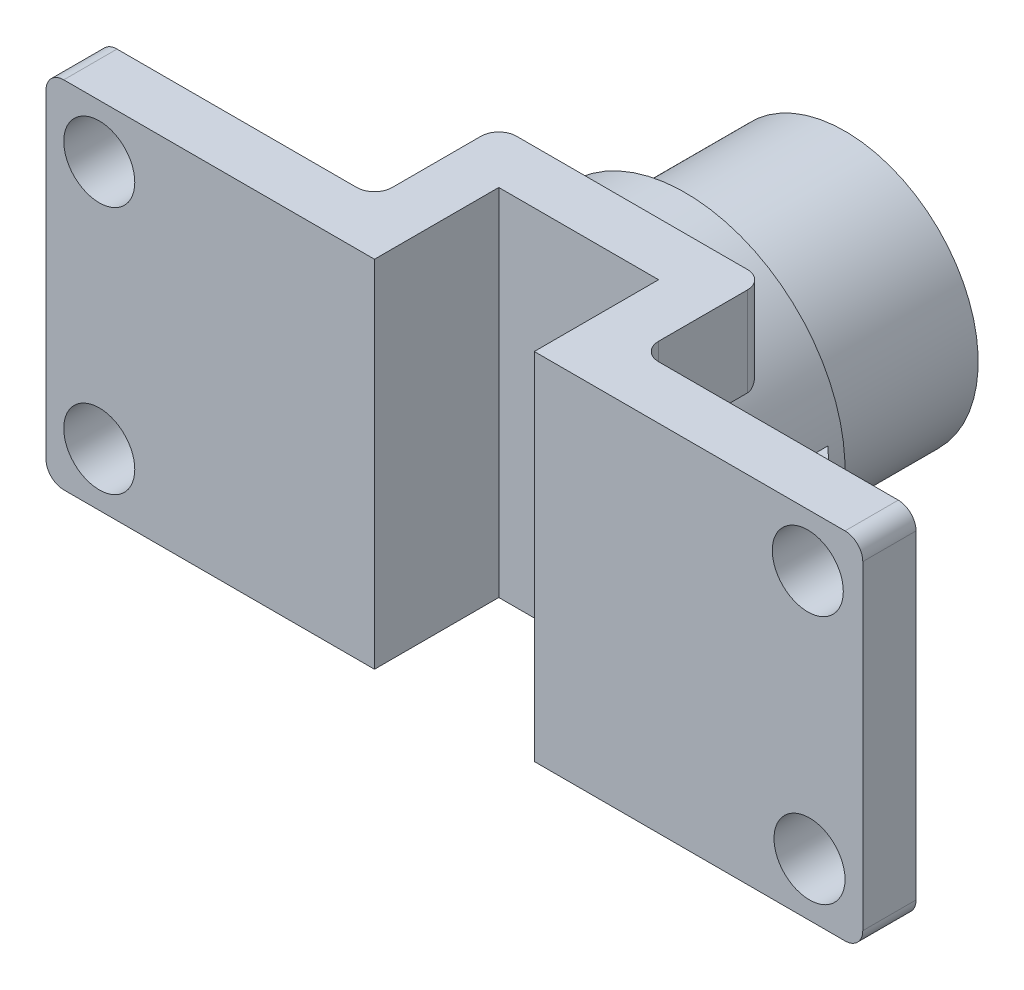
from build123d import *

# Parameters (mm, degrees)
BOSS_EXTRUDE1_DEPTH = 40
BOSS_EXTRUDE2_REACH = 105.634
SKETCH2_R           = 18
SKETCH3_R           = 15
SKETCH3_R_2         = 10
BOSS_EXTRUDE3_DEPTH = 18
BOSS_EXTRUDE5_DEPTH = 3
SKETCH5_W           = 20
SKETCH5_H           = 1.869521783
BOSS_EXTRUDE6_DEPTH = 6
SKETCH6_W           = 20
SKETCH6_H           = 1.869521783
BOSS_EXTRUDE7_DEPTH = 6
SKETCH8_W           = 18
SKETCH8_H           = 14
CUT_EXTRUDE1_DEPTH  = 119.321595713
FILLET1_R           = 2
SKETCH9_R           = 4
CUT_EXTRUDE2_DEPTH  = 6


with BuildPart() as part:
    # Sketch1 → Boss-Extrude1 (new body)
    with BuildSketch(Plane(origin=(0, 0, 0), x_dir=(1, 0, 0), z_dir=(0, 1, 0))):
        with BuildLine():
            Line((0, 0), (92, 0))
            Line((92, 0), (92, 6))
            Line((92, 6), (63, 6))
            ThreePointArc((63, 6), (61.585786438, 6.585786438), (61, 8))
            Line((61, 8), (61, 18))
            ThreePointArc((61, 18), (60.414213562, 19.414213562), (59, 20))
            Line((59, 20), (33, 20))
            ThreePointArc((33, 20), (31.585786438, 19.414213562), (31, 18))
            Line((31, 18), (31, 8))
            ThreePointArc((31, 8), (30.414213562, 6.585786438), (29, 6))
            Line((29, 6), (0, 6))
            Line((0, 6), (0, 0))
        make_face()
    extrude(amount=BOSS_EXTRUDE1_DEPTH)

    # Boss-Extrude2: up to this face of the body (flat: up to its plane)
    boss_extrude2_end = Plane(part.part.faces().sort_by_distance((14.5, 20, -6))[0])
    # Sketch2 → Boss-Extrude2 (add, up to the picked face)
    with BuildSketch(Plane(origin=(0, 0, -26), x_dir=(-1, 0, 0), z_dir=(0, 0, -1)), mode=Mode.PRIVATE) as boss_extrude2_sk1:
        with Locations((-46, 20)):
            Circle(SKETCH2_R)
    boss_extrude2_tool1 = split(extrude(boss_extrude2_sk1.sketch, amount=-BOSS_EXTRUDE2_REACH, mode=Mode.PRIVATE), bisect_by=boss_extrude2_end, keep=Keep.BOTH, mode=Mode.PRIVATE)
    add(boss_extrude2_tool1.solids().sort_by(Axis((46, 20, -26), (0, 0, 1)))[0])

    # Sketch3 → Boss-Extrude3 (add)
    with BuildSketch(Plane(origin=(0, 0, -26), x_dir=(-1, 0, 0), z_dir=(0, 0, -1))):
        with Locations((-46, 20)):
            Circle(SKETCH3_R)
        with Locations((-46, 20)):
            Circle(SKETCH3_R_2, mode=Mode.SUBTRACT)
    extrude(amount=BOSS_EXTRUDE3_DEPTH)

    # Sketch4 → Boss-Extrude5 (add, symmetric)
    with BuildSketch(Plane(origin=(0, 20, 0), x_dir=(-1, 0, 0), z_dir=(0, -1, 0))):
        Polygon((-61.98666838, 26), (-83, 6), (-61.98666838, 6), align=None)
        Polygon((-28.035534547, 26), (-9, 6), (-28.035534547, 6), align=None)
    extrude(amount=BOSS_EXTRUDE5_DEPTH, both=True)

    # Sketch5 → Boss-Extrude6 (add)
    with BuildSketch(Plane(origin=(28.035534547, 0, 0), x_dir=(0, 0, -1), z_dir=(1, 0, 0))):
        with Locations((16, 17.934760891)):
            Rectangle(SKETCH5_W, SKETCH5_H)
    extrude(amount=BOSS_EXTRUDE6_DEPTH)

    # Sketch6 → Boss-Extrude7 (add)
    with BuildSketch(Plane(origin=(28.035534547, 0, 0), x_dir=(0, 0, -1), z_dir=(1, 0, 0))):
        with Locations((16, 22.065239109)):
            Rectangle(SKETCH6_W, SKETCH6_H)
    extrude(amount=BOSS_EXTRUDE7_DEPTH)

    # Sketch8 → Cut-Extrude1 (cut, through all)
    with BuildSketch(Plane(origin=(0, 60, 0), x_dir=(1, 0, 0), z_dir=(0, 1, 0))):
        with Locations((46, 7)):
            Rectangle(SKETCH8_W, SKETCH8_H)
    extrude(amount=-CUT_EXTRUDE1_DEPTH, mode=Mode.SUBTRACT)

    # Fillet1
    fillet1_edges = [part.edges().sort_by_distance(p)[0] for p in [
        (92, 40, -3),
        (92, 0, -3),
        (0, 0, -3),
        (0, 40, -3),
    ]]
    fillet(fillet1_edges, radius=FILLET1_R)

    # Sketch9 → Cut-Extrude2 (cut)
    with BuildSketch(Plane.XY):
        with Locations((86, 6)):
            Circle(SKETCH9_R)
        with Locations((85.806998085, 34)):
            Circle(SKETCH9_R)
        with Locations((6, 34)):
            Circle(SKETCH9_R)
        with Locations((6, 6)):
            Circle(SKETCH9_R)
    extrude(amount=-CUT_EXTRUDE2_DEPTH, mode=Mode.SUBTRACT)


solid = part.part
